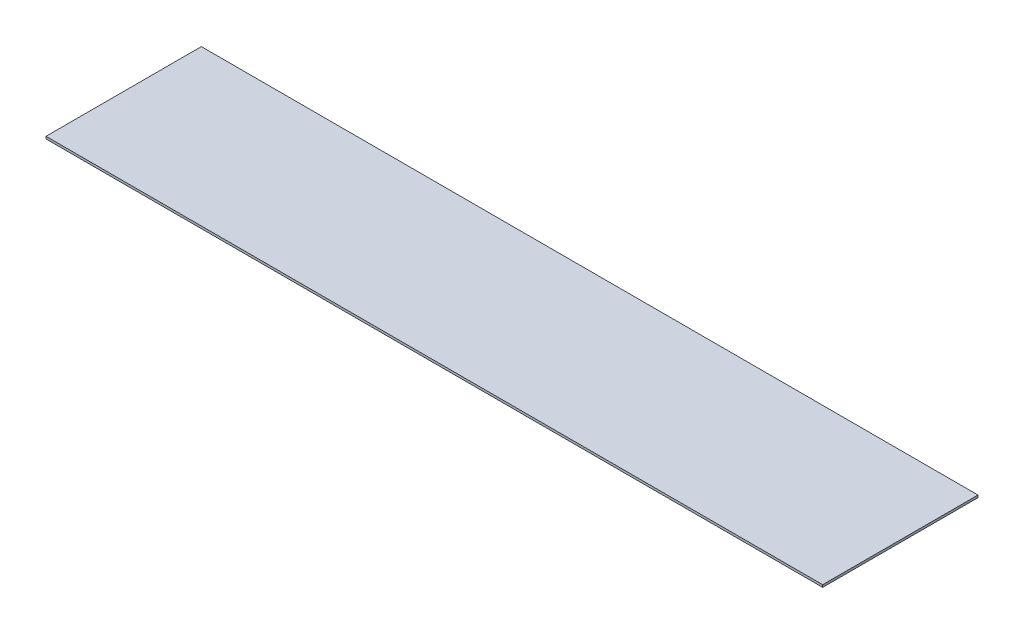
from build123d import *

# Parameters (mm, degrees)
SKETCH1_W      = 1000
SKETCH1_H      = 200
EXTRUDE1_DEPTH = 3


with BuildPart() as part:
    # Sketch1 → Extrude1 (new body)
    with BuildSketch(Plane(origin=(0, 0, 0), x_dir=(1, 0, 0), z_dir=(0, 1, 0))):
        Rectangle(SKETCH1_W, SKETCH1_H)
    extrude(amount=EXTRUDE1_DEPTH)


solid = part.part
